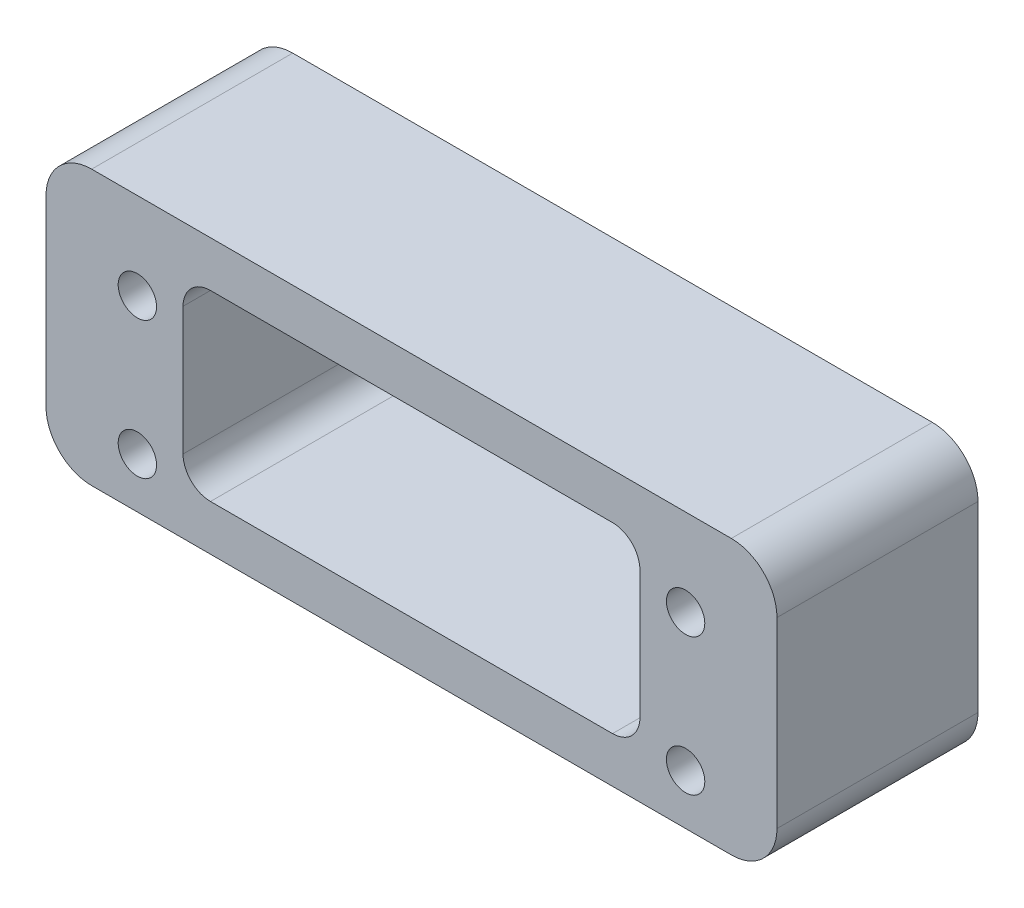
from build123d import *

# Parameters (mm, degrees)
SKETCH_1_W          = 80
SKETCH_1_H          = 30
EXTRUDE_1_DEPTH     = 11
FILLET_1_R          = 5
SKETCH_2_R          = 2.1
SKETCH_2_W          = 50
SKETCH_2_H          = 20
CUT_EXTRUDE_1_DEPTH = 49.052055107
FILLET_2_R          = 3


with BuildPart() as part:
    # 草图1 → 凸台-拉伸1 (new, symmetric)
    with BuildSketch(Plane.XY):
        Rectangle(SKETCH_1_W, SKETCH_1_H)
    extrude(amount=EXTRUDE_1_DEPTH, both=True)

    # 圆角1
    fillet_1_edges = [part.edges().sort_by_distance(p)[0] for p in [
        (40, -15, 0),
        (-40, -15, 0),
        (-40, 15, 0),
        (40, 15, 0),
    ]]
    fillet(fillet_1_edges, radius=FILLET_1_R)

    # 草图2 → 切除-拉伸1 (cut, through all)
    with BuildSketch(Plane.XY.offset(11)):
        with Locations((-30, 5.5)):
            Circle(SKETCH_2_R)
        with Locations((30, 5.5)):
            Circle(SKETCH_2_R)
        with Locations((30, -9.5)):
            Circle(SKETCH_2_R)
        with Locations((-30, -9.5)):
            Circle(SKETCH_2_R)
        Rectangle(SKETCH_2_W, SKETCH_2_H)
    extrude(amount=-CUT_EXTRUDE_1_DEPTH, mode=Mode.SUBTRACT)

    # 圆角2
    fillet_2_edges = [part.edges().sort_by_distance(p)[0] for p in [
        (25, 10, 0),
        (25, -10, 0),
        (-25, -10, 0),
        (-25, 10, 0),
    ]]
    fillet(fillet_2_edges, radius=FILLET_2_R)


solid = part.part
